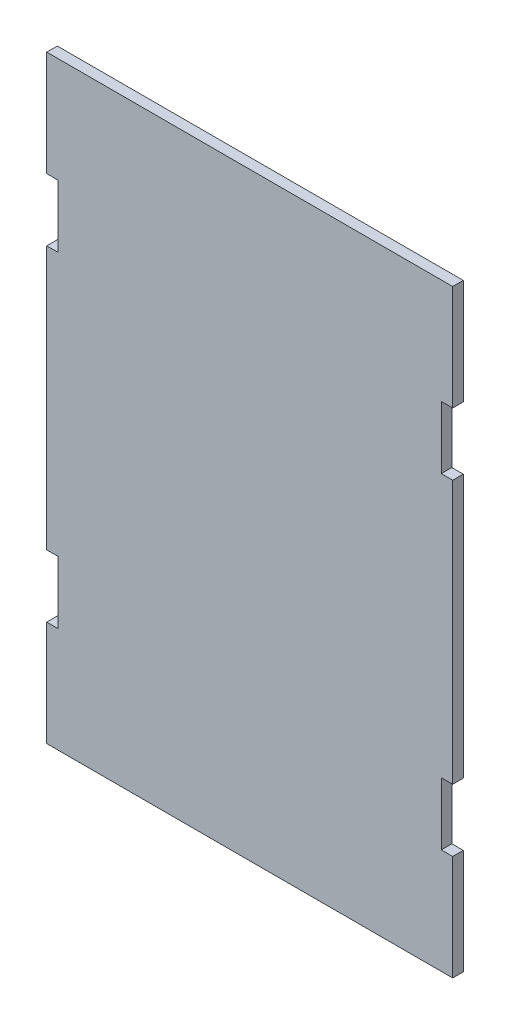
from build123d import *

# Parameters (mm, degrees)
EXTRUDE_1_DEPTH = 12


with BuildPart() as part:
    # Эскиз1 → Бобышка-Вытянуть1 (new body)
    with BuildSketch(Plane.XY):
        Polygon((-230.5, 220.5), (-217.5, 220.5), (-217.5, 149.5), (-230.5, 149.5), (-230.5, -149.5), (-217.5, -149.5), (-217.5, -220.5), (-230.5, -220.5), (-230.5, -340), (230.5, -340), (230.5, -220.5), (217.5, -220.5), (217.5, -149.5), (230.5, -149.5), (230.5, 149.5), (217.5, 149.5), (217.5, 220.5), (230.5, 220.5), (230.5, 340), (-230.5, 340), align=None)
    extrude(amount=EXTRUDE_1_DEPTH)


solid = part.part
